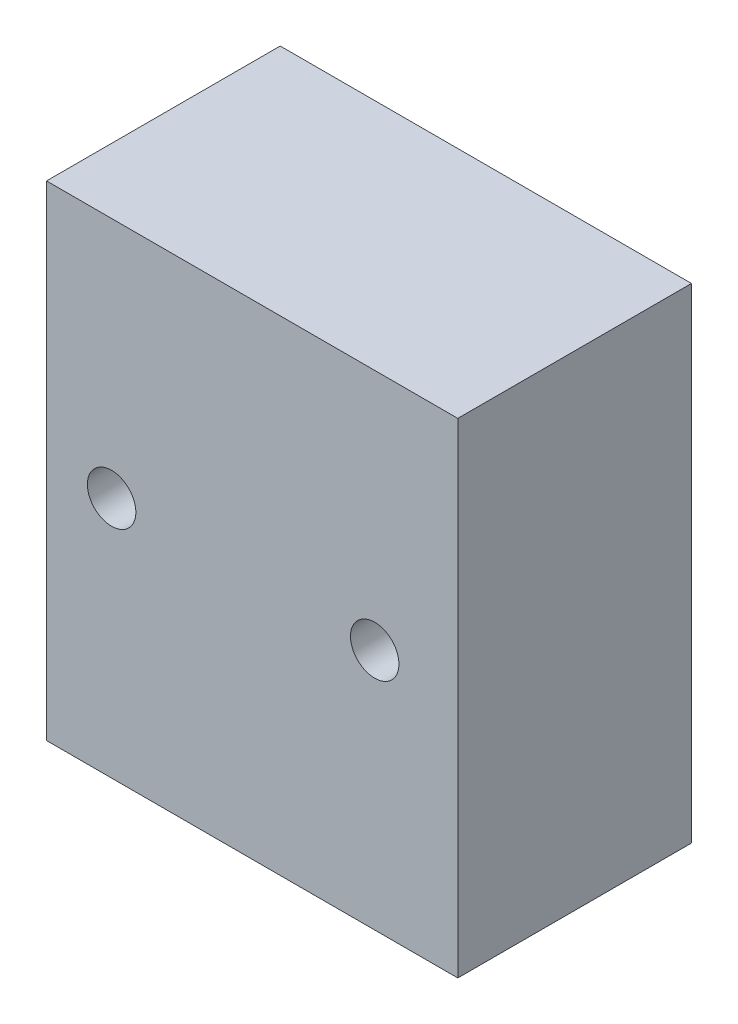
from build123d import *

# Parameters (mm, degrees)
SKETCH_1_W          = 29.7
SKETCH_1_H          = 35
EXTRUDE_1_DEPTH     = 16.875
SKETCH_2_R          = 1.75
CUT_EXTRUDE_1_DEPTH = 16.875


with BuildPart() as part:
    # 草圖1 → 填料-伸長1 (new body)
    with BuildSketch(Plane.XY):
        Rectangle(SKETCH_1_W, SKETCH_1_H)
    extrude(amount=EXTRUDE_1_DEPTH)

    # 草圖2 → 除料-伸長1 (cut)
    with BuildSketch(Plane(origin=(0, 0, 0), x_dir=(-1, 0, 0), z_dir=(0, 0, -1))):
        with Locations((-8.85, 0)):
            Circle(SKETCH_2_R)
        with Locations((10.15, 0)):
            Circle(SKETCH_2_R)
    extrude(amount=-CUT_EXTRUDE_1_DEPTH, mode=Mode.SUBTRACT)


solid = part.part
